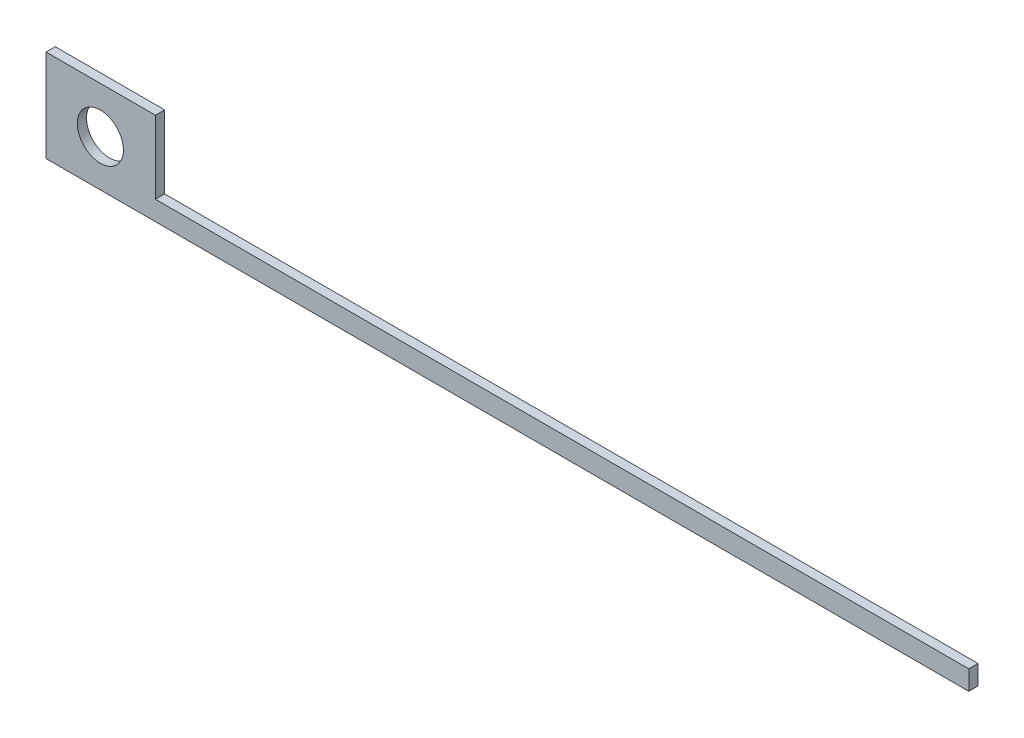
from build123d import *

# Parameters (mm, degrees)
SKETCH1_W           = 1000
SKETCH1_H           = 100
BOSS_EXTRUDE1_DEPTH = 10
SKETCH2_R           = 25
CUT_EXTRUDE1_DEPTH  = 10
SKETCH3_W           = 881.396206235
SKETCH3_H           = 78.870629157
CUT_EXTRUDE2_DEPTH  = 10


with BuildPart() as part:
    # Sketch1 → Boss-Extrude1 (new body)
    with BuildSketch(Plane.XY):
        Rectangle(SKETCH1_W, SKETCH1_H)
    extrude(amount=BOSS_EXTRUDE1_DEPTH)

    # Sketch2 → Cut-Extrude1 (cut)
    with BuildSketch(Plane.XY.offset(10)):
        with Locations((-441.109876755, 0)):
            Circle(SKETCH2_R)
    extrude(amount=-CUT_EXTRUDE1_DEPTH, mode=Mode.SUBTRACT)

    # Sketch3 → Cut-Extrude2 (cut)
    with BuildSketch(Plane.XY.offset(10)):
        with Locations((59.301896883, 10.564685421)):
            Rectangle(SKETCH3_W, SKETCH3_H)
    extrude(amount=-CUT_EXTRUDE2_DEPTH, mode=Mode.SUBTRACT)


solid = part.part
